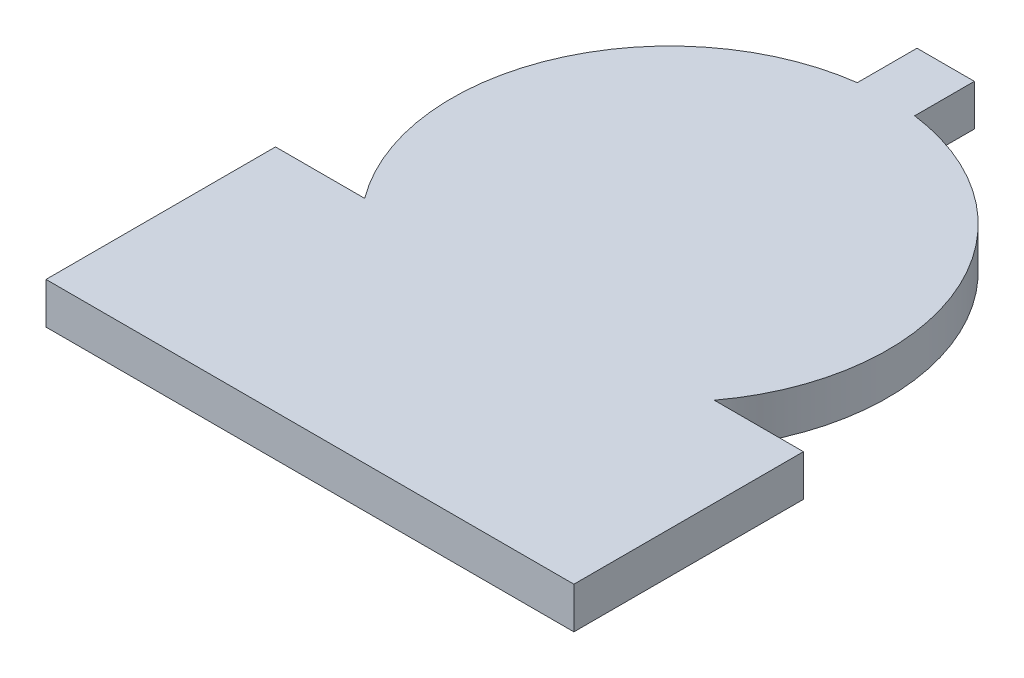
from build123d import *

# Parameters (mm, degrees)
BOSS_EXTRUDE1_DEPTH = 4.572


with BuildPart() as part:
    # Sketch1 → Boss-Extrude1 (new body)
    with BuildSketch(Plane(origin=(0, 0, 0), x_dir=(1, 0, 0), z_dir=(0, 1, 0))):
        with BuildLine():
            Line((-3.175, 30.524206416), (3.175, 30.524206416))
            Line((3.175, 30.524206416), (3.175, 23.920206416))
            ThreePointArc((3.175, 23.920206416), (22.234995228, 9.373467192), (19.341279759, -14.428159872))
            Line((19.341279759, -14.428159872), (29.21, -14.428159872))
            Line((29.21, -14.428159872), (29.21, -39.828159872))
            Line((29.21, -39.828159872), (-29.21, -39.828159872))
            Line((-29.21, -39.828159872), (-29.21, -14.428159872))
            Line((-29.21, -14.428159872), (-19.341279759, -14.428159872))
            ThreePointArc((-19.341279759, -14.428159872), (-22.234995228, 9.373467192), (-3.175, 23.920206416))
            Line((-3.175, 23.920206416), (-3.175, 30.524206416))
        make_face()
    extrude(amount=BOSS_EXTRUDE1_DEPTH)


solid = part.part
